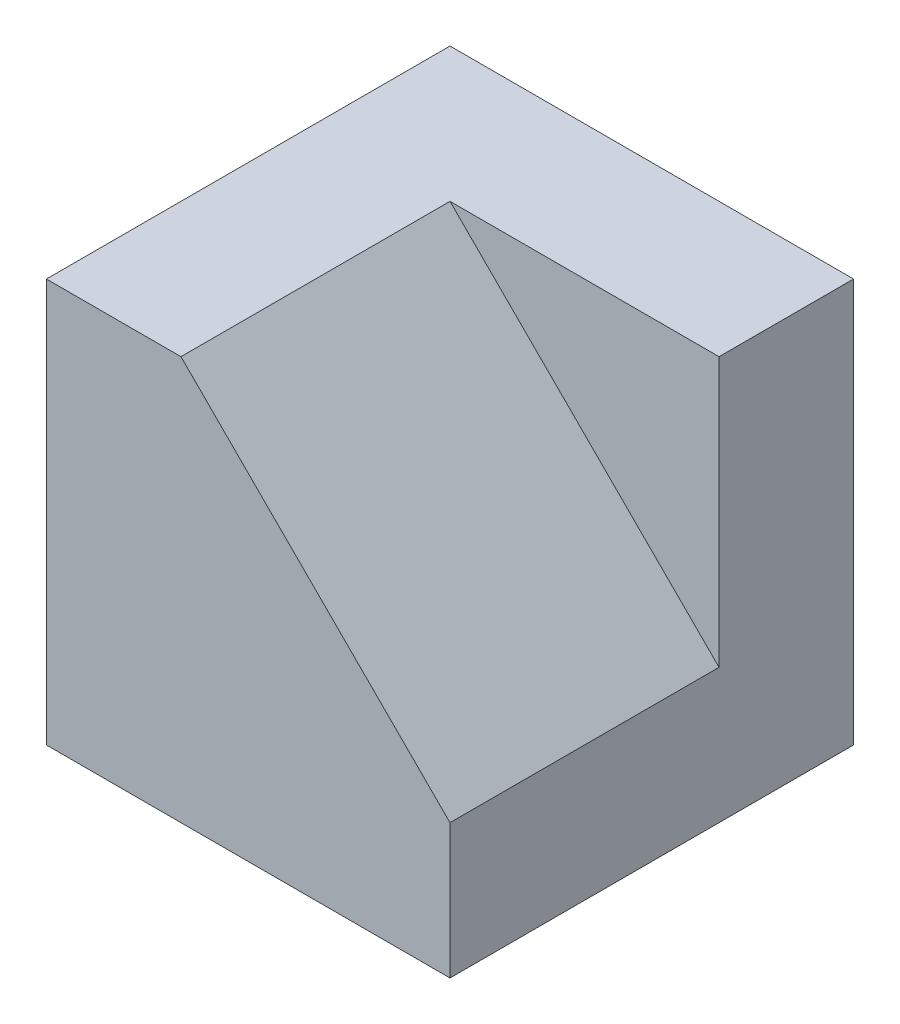
from build123d import *

# Parameters (mm, degrees)
RESSALTO_EXTRUS_O1_DEPTH = 40
ESBO_O2_W                = 60
ESBO_O2_H                = 60
RESSALTO_EXTRUS_O2_DEPTH = 20


with BuildPart() as part:
    # Esboço1 → Ressalto-extrusão1 (new body)
    with BuildSketch(Plane.XY):
        Polygon((0, 0), (60, 0), (60, 20), (20, 60), (0, 60), align=None)
    extrude(amount=RESSALTO_EXTRUS_O1_DEPTH)

    # Esboço2 → Ressalto-extrusão2 (add)
    with BuildSketch(Plane(origin=(0, 0, 0), x_dir=(-1, 0, 0), z_dir=(0, 0, -1))):
        with Locations((-30, 30)):
            Rectangle(ESBO_O2_W, ESBO_O2_H)
    extrude(amount=RESSALTO_EXTRUS_O2_DEPTH)


solid = part.part
